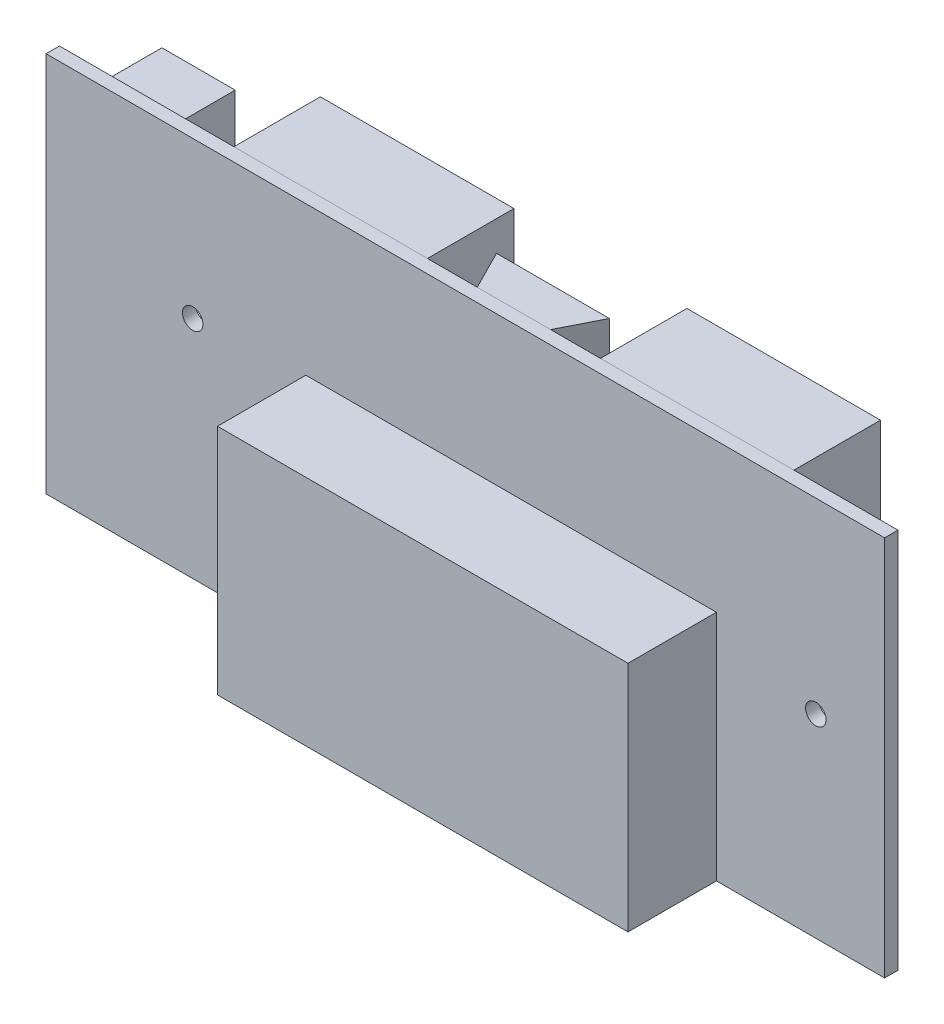
from build123d import *

# Parameters (mm, degrees)
SKETCH_1_W          = 57.19
SKETCH_1_H          = 26
EXTRUDE_1_DEPTH     = 0.91
SKETCH_2_W          = 28
SKETCH_2_H          = 15.87
EXTRUDE_2_DEPTH     = 6.03
SKETCH_3_R          = 0.7
CUT_EXTRUDE_1_DEPTH = 3
SKETCH_4_W          = 13.2
SKETCH_4_H          = 5.9
EXTRUDE_3_DEPTH     = 10
EXTRUDE_3_2_DEPTH   = 10
EXTRUDE_3_3_DEPTH   = 10
SKETCH_5_W          = 6.99
SKETCH_5_H          = 6
EXTRUDE_4_DEPTH     = 5
SKETCH_6_R          = 1
EXTRUDE_5_DEPTH     = 1


with BuildPart() as part:
    # Эскиз1 → Бобышка-Вытянуть1 (new body)
    with BuildSketch(Plane.XY):
        with Locations((28.595, 13)):
            Rectangle(SKETCH_1_W, SKETCH_1_H)
    extrude(amount=-EXTRUDE_1_DEPTH)

    # Эскиз2 → Бобышка-Вытянуть2 (add)
    with BuildSketch(Plane.XY):
        with Locations((31.72, 7.935)):
            Rectangle(SKETCH_2_W, SKETCH_2_H)
    extrude(amount=EXTRUDE_2_DEPTH)

    # Эскиз3 → Вырез-Вытянуть1 (cut)
    with BuildSketch(Plane.XY):
        with Locations((10, 15.36)):
            Circle(SKETCH_3_R)
        with Locations((52.5, 13.25)):
            Circle(SKETCH_3_R)
    extrude(amount=-CUT_EXTRUDE_1_DEPTH, mode=Mode.SUBTRACT)


with BuildPart() as body_2:
    # Эскиз4 → Бобышка-Вытянуть3 (new body)
    with BuildSketch(Plane.XZ.offset(-26)):
        with Locations((18.5, -3.86)):
            Rectangle(SKETCH_4_W, SKETCH_4_H)
    extrude(amount=EXTRUDE_3_DEPTH)


with BuildPart() as body_3:
    # Эскиз4 → Extrude 3 2 (new body)
    with BuildSketch(Plane.XZ.offset(-26)):
        with Locations((43.5, -3.86)):
            Rectangle(SKETCH_4_W, SKETCH_4_H)
    extrude(amount=EXTRUDE_3_2_DEPTH)


with BuildPart() as body_4:
    # Эскиз4 → Extrude 3 3 (new body)
    with BuildSketch(Plane.XZ.offset(-26)):
        Polygon((33.5, -0.91), (28.5, -0.91), (27.15, -3.57), (34.85, -3.57), align=None)
    extrude(amount=EXTRUDE_3_3_DEPTH)


with BuildPart() as body_5:
    # Эскиз5 → Бобышка-Вытянуть4 (new body)
    with BuildSketch(Plane.ZY):
        with Locations((-4.405, 19.4)):
            Rectangle(SKETCH_5_W, SKETCH_5_H)
    extrude(amount=-EXTRUDE_4_DEPTH)

    # Эскиз6 → Бобышка-Вытянуть5 (add)
    with BuildSketch(Plane.ZY):
        with Locations((-4.405, 19.4)):
            Circle(SKETCH_6_R)
    extrude(amount=EXTRUDE_5_DEPTH)


solid = Compound([part.part, body_2.part, body_3.part, body_4.part, body_5.part])
